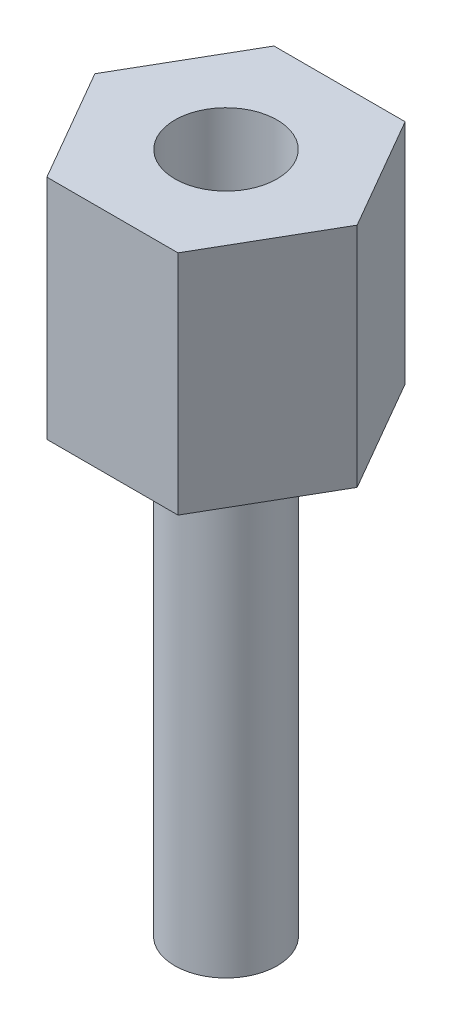
from build123d import *

# Parameters (mm, degrees)
BOSS_EXTRU_1_DEPTH      = 6
ESQUISSE2_R             = 1.353837959
BOSS_EXTRU_2_DEPTH      = 12
ESQUISSE3_R             = 1.35
ENL_V_MAT_EXTRU_1_DEPTH = 5


with BuildPart() as part:
    # Esquisse1 → Boss.-Extru.1 (new body)
    with BuildSketch(Plane(origin=(0, 0, 0), x_dir=(1, 0, 0), z_dir=(0, 1, 0))):
        Polygon((3.464101615, 0), (1.732050808, 3), (-1.732050808, 3), (-3.464101615, 0), (-1.732050808, -3), (1.732050808, -3), align=None)
    extrude(amount=BOSS_EXTRU_1_DEPTH)

    # Esquisse2 → Boss.-Extru.2 (add)
    with BuildSketch(Plane.XZ):
        with Locations(Location((0, 0, 0), (0, 0, 90))):
            Circle(ESQUISSE2_R)
    extrude(amount=BOSS_EXTRU_2_DEPTH)

    # Esquisse3 → Enlèv. mat.-Extru.1 (cut)
    with BuildSketch(Plane(origin=(0, 6, 0), x_dir=(1, 0, 0), z_dir=(0, 1, 0))):
        with Locations(Location((0, 0, 0), (0, 0, 270))):
            Circle(ESQUISSE3_R)
    extrude(amount=-ENL_V_MAT_EXTRU_1_DEPTH, mode=Mode.SUBTRACT)


solid = part.part
